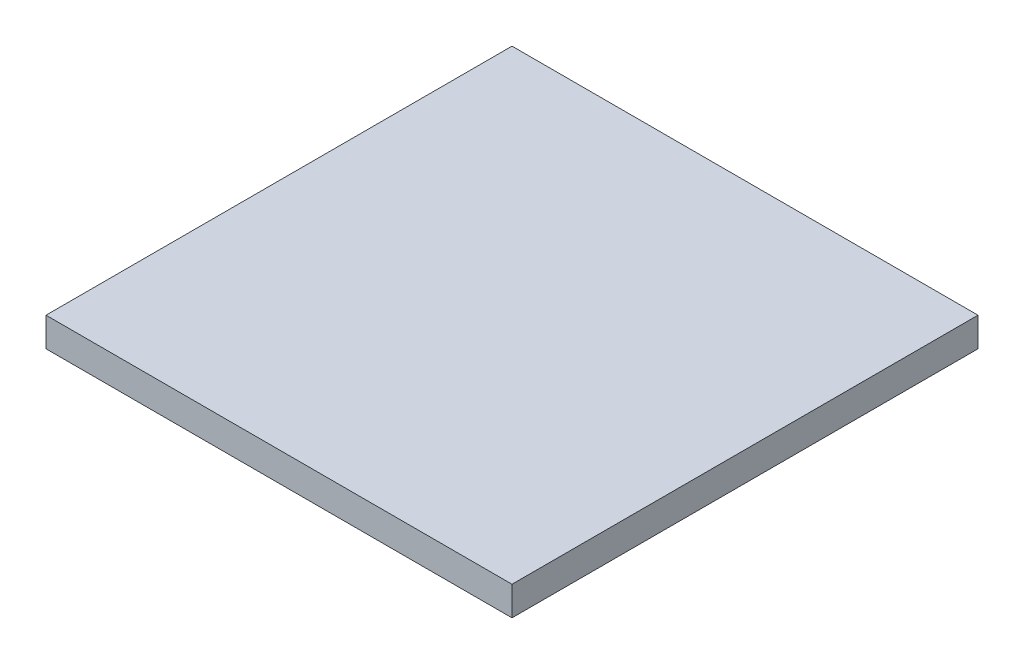
from build123d import *

# Parameters (mm, degrees)
SKETCH1_W           = 160
SKETCH1_H           = 160
BOSS_EXTRUDE1_DEPTH = 10


with BuildPart() as part:
    # Sketch1 → Boss-Extrude1 (new body)
    with BuildSketch(Plane(origin=(0, 0, 0), x_dir=(1, 0, 0), z_dir=(0, 1, 0))):
        with Locations((80, -80)):
            Rectangle(SKETCH1_W, SKETCH1_H)
    extrude(amount=BOSS_EXTRUDE1_DEPTH)


solid = part.part
